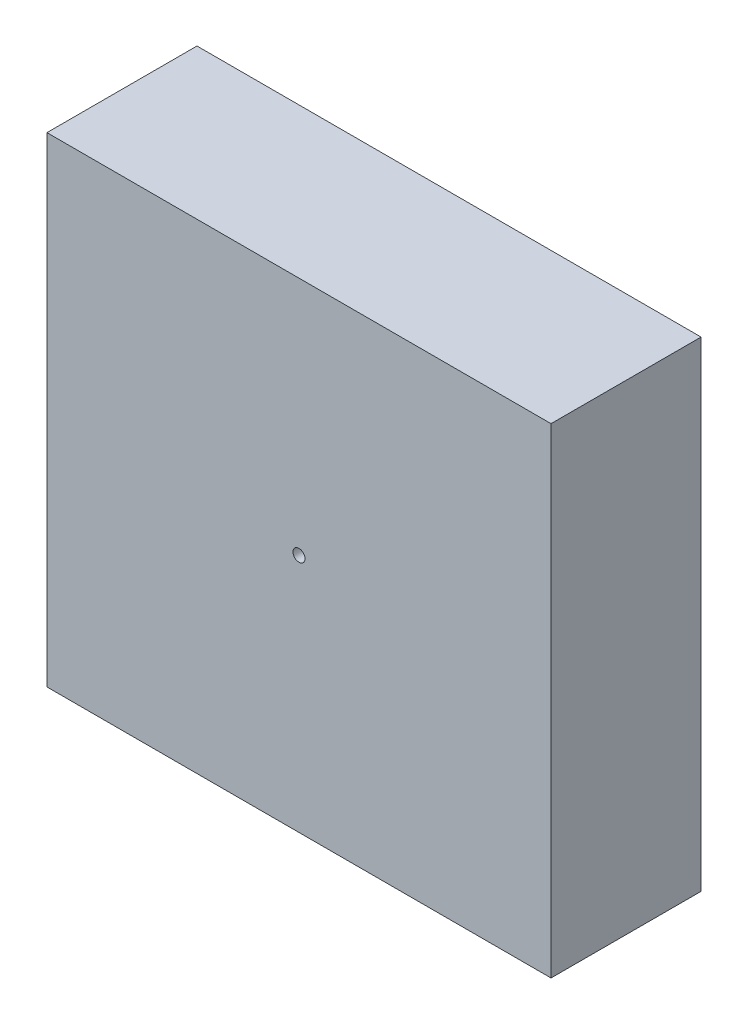
from build123d import *

# Parameters (mm, degrees)
CROQUIS1_W              = 84
CROQUIS1_H              = 80
SALIENTE_EXTRUIR1_DEPTH = 25
CROQUIS2_R              = 1
CORTAR_EXTRUIR1_DEPTH   = 10


with BuildPart() as part:
    # Croquis1 → Saliente-Extruir1 (new body)
    with BuildSketch(Plane.XY):
        Rectangle(CROQUIS1_W, CROQUIS1_H)
    extrude(amount=SALIENTE_EXTRUIR1_DEPTH)

    # Croquis2 → Cortar-Extruir1 (cut)
    with BuildSketch(Plane.XY.offset(25)):
        Circle(CROQUIS2_R)
    extrude(amount=-CORTAR_EXTRUIR1_DEPTH, mode=Mode.SUBTRACT)


solid = part.part
